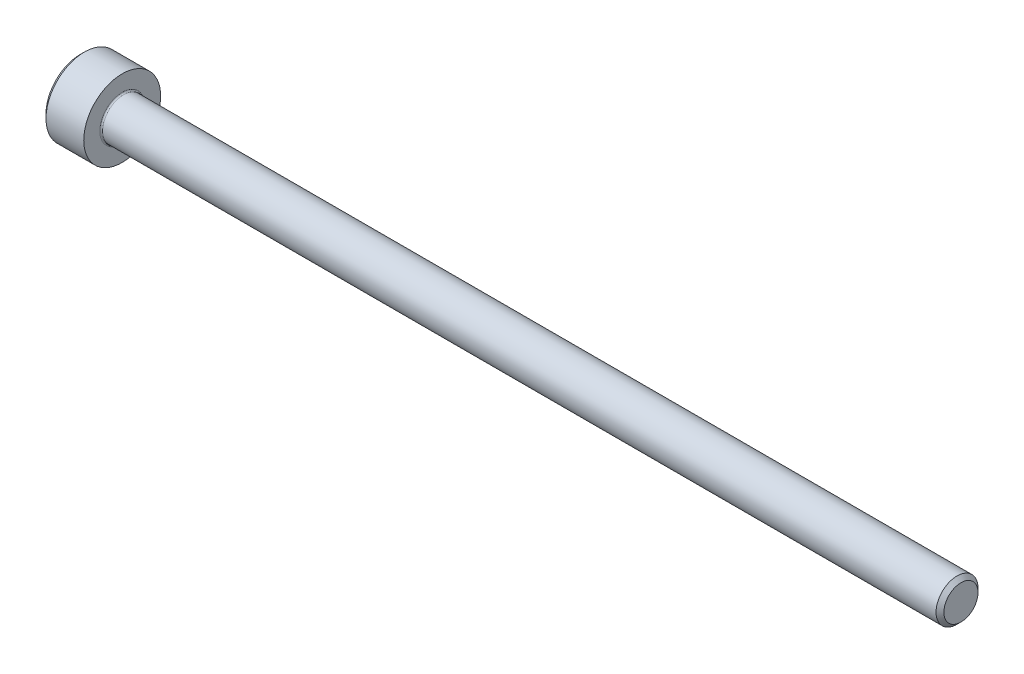
from build123d import *

# Parameters (mm, degrees)
FILLET1_R   = 0.1
HEX_2_DEPTH = 1.3


with BuildPart() as part:
    # BodySke → Base-Revolve (revolve)
    with BuildSketch(Plane.XY, mode=Mode.PRIVATE) as base_revolve_sk:
        Polygon((0, 0), (0, 2.45), (0.3, 2.75), (3, 2.75), (3, 1.5), (62.7195, 1.5), (63, 1.2195), (63, 0), align=None)
    revolve(base_revolve_sk.sketch.rotate(Axis((-31.75, 0, 0), (1, 0, 0)), 90), axis=Axis((-31.75, 0, 0), (1, 0, 0)))

    # Fillet1
    fillet1_edges = [part.edges().sort_by_distance(p)[0] for p in [
        (3, 0, -1.5),
    ]]
    fillet(fillet1_edges, radius=FILLET1_R)

    # Sketch2 → Hex-PreBroach (revolve, cut)
    with BuildSketch(Plane.XY, mode=Mode.PRIVATE) as hex_prebroach_sk:
        Polygon((0, 1.28), (1.3, 1.28), (2.039008345, 0), (0, 0), align=None)
    revolve(hex_prebroach_sk.sketch.rotate(Axis((0, 0, 0), (1, 0, 0)), 90), axis=Axis((0, 0, 0), (1, 0, 0)), mode=Mode.SUBTRACT)

    # Sketch3 → Hex 2 (cut)
    with BuildSketch(Plane(origin=(0, 0, 0), x_dir=(0, 0.500000000000001, 0.866025403784438), z_dir=(-1, 0, 0))):
        Polygon((0.739008345, 1.28), (-0.739008345, 1.28), (-1.478016689, 0), (-0.739008345, -1.28), (0.739008345, -1.28), (1.478016689, 0), align=None)
    extrude(amount=-HEX_2_DEPTH, mode=Mode.SUBTRACT)


solid = part.part
